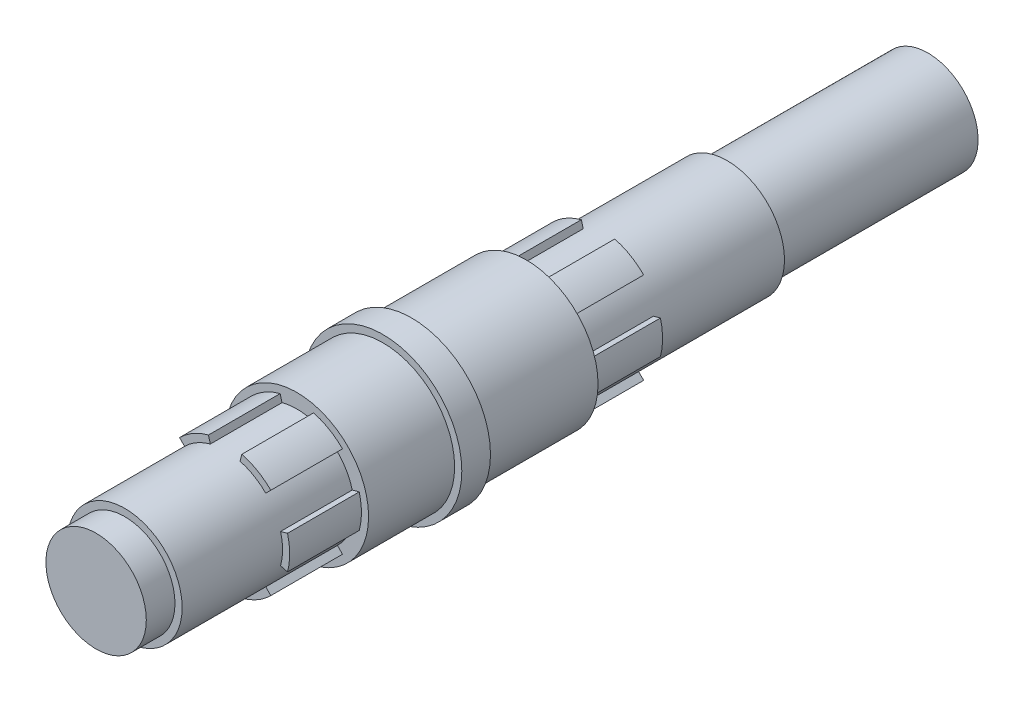
from build123d import *

# Parameters (mm, degrees)
CUT_EXTRUDE2_START  = -31.75
CUT_EXTRUDE2_DEPTH  = 31.75
CIRPATTERN1_COUNT   = 6
CUT_EXTRUDE3_DEPTH  = 31.75
CIRPATTERN2_COUNT   = 6
CUT_EXTRUDE4_START  = -12.7
SKETCH7_R           = 25.4
SKETCH7_R_2         = 22.225
CUT_EXTRUDE4_DEPTH  = 12.7
SKETCH8_R           = 25.4
SKETCH8_R_2         = 22.225
CUT_EXTRUDE5_DEPTH  = 12.7
BOSS_EXTRUDE1_START = -38.1
SKETCH9_R           = 34.925
BOSS_EXTRUDE1_DEPTH = 12.7
BOSS_EXTRUDE2_START = 76.2
SKETCH10_R          = 22.225
BOSS_EXTRUDE2_DEPTH = 76.2


with BuildPart() as part:
    # Sketch3 → Revolve1 (revolve)
    with BuildSketch(Plane(origin=(0, 0, 0), x_dir=(0, 0, -1), z_dir=(1, 0, 0)), mode=Mode.PRIVATE) as revolve1_sk:
        Polygon((-146.05, 0), (-146.05, 25.4), (-88.9, 25.4), (-88.9, 28.575), (-57.15, 28.575), (-57.15, 31.75), (44.45, 31.75), (44.45, 28.575), (76.2, 28.575), (76.2, 25.4), (146.05, 25.4), (146.05, 0), align=None)
    revolve(revolve1_sk.sketch.rotate(Axis((0, 0, 128.279136691), (0, 0, -1)), 90), axis=Axis((0, 0, 128.279136691), (0, 0, -1)))

    # Sketch5 → Cut-Extrude2 (cut)
    with BuildSketch(Plane.XY.offset(88.9).offset(CUT_EXTRUDE2_START)):
        with BuildLine():
            Line((0, 28.575), (0, 25.4))
            ThreePointArc((0, 25.4), (3.315365282, 25.182699479), (6.574003746, 24.534515988))
            Line((6.574003746, 24.534515988), (7.395754214, 27.601330486))
            ThreePointArc((7.395754214, 27.601330486), (3.729785943, 28.330536914), (0, 28.575))
        make_face()
        with BuildLine():
            ThreePointArc((-6.574003746, 24.534515988), (-3.315365282, 25.182699479), (0, 25.4))
            Line((0, 25.4), (0, 28.575))
            ThreePointArc((0, 28.575), (-3.729785943, 28.330536914), (-7.395754214, 27.601330486))
            Line((-7.395754214, 27.601330486), (-6.574003746, 24.534515988))
        make_face()
    cut_extrude2 = extrude(amount=CUT_EXTRUDE2_DEPTH, mode=Mode.SUBTRACT)

    # CirPattern1: Cut-Extrude2 ×6 about axis
    cirpattern1_axis = Axis((0, 0, 0), (0, 0, 1))
    for i in range(1, CIRPATTERN1_COUNT):
        add(cut_extrude2.rotate(cirpattern1_axis, i * 360 / CIRPATTERN1_COUNT), mode=Mode.SUBTRACT)

    # Sketch6 → Cut-Extrude3 (cut)
    with BuildSketch(Plane(origin=(0, 0, -76.2), x_dir=(-1, 0, 0), z_dir=(0, 0, -1))):
        with BuildLine():
            Line((0, 28.575), (0, 25.4))
            ThreePointArc((0, 25.4), (3.315365282, 25.182699479), (6.574003746, 24.534515988))
            Line((6.574003746, 24.534515988), (7.395754214, 27.601330486))
            ThreePointArc((7.395754214, 27.601330486), (3.729785943, 28.330536914), (0, 28.575))
        make_face()
        with BuildLine():
            ThreePointArc((-6.574003746, 24.534515988), (-3.315365282, 25.182699479), (0, 25.4))
            Line((0, 25.4), (0, 28.575))
            ThreePointArc((0, 28.575), (-3.729785943, 28.330536914), (-7.395754214, 27.601330486))
            Line((-7.395754214, 27.601330486), (-6.574003746, 24.534515988))
        make_face()
    cut_extrude3 = extrude(amount=-CUT_EXTRUDE3_DEPTH, mode=Mode.SUBTRACT)

    # CirPattern2: Cut-Extrude3 ×6 about axis
    cirpattern2_axis = Axis((0, 0, 0), (0, 0, 1))
    for i in range(1, CIRPATTERN2_COUNT):
        add(cut_extrude3.rotate(cirpattern2_axis, i * 360 / CIRPATTERN2_COUNT), mode=Mode.SUBTRACT)

    # Sketch7 → Cut-Extrude4 (cut)
    with BuildSketch(Plane.XY.offset(146.05).offset(CUT_EXTRUDE4_START)):
        Circle(SKETCH7_R)
        Circle(SKETCH7_R_2, mode=Mode.SUBTRACT)
    extrude(amount=CUT_EXTRUDE4_DEPTH, mode=Mode.SUBTRACT)

    # Sketch8 → Cut-Extrude5 (cut)
    with BuildSketch(Plane(origin=(0, 0, -146.05), x_dir=(-1, 0, 0), z_dir=(0, 0, -1))):
        with Locations(Location((0, 0, 0), (0, 0, 195))):
            Circle(SKETCH8_R)
        with Locations(Location((0, 0, 0), (0, 0, 180))):
            Circle(SKETCH8_R_2, mode=Mode.SUBTRACT)
    extrude(amount=-CUT_EXTRUDE5_DEPTH, mode=Mode.SUBTRACT)

    # Sketch9 → Boss-Extrude1 (add)
    with BuildSketch(Plane.XY.offset(57.15).offset(BOSS_EXTRUDE1_START)):
        Circle(SKETCH9_R)
    extrude(amount=-BOSS_EXTRUDE1_DEPTH)

    # Sketch10 → Boss-Extrude2 (add)
    with BuildSketch(Plane(origin=(0, 0, -146.05), x_dir=(-1, 0, 0), z_dir=(0, 0, -1)).offset(BOSS_EXTRUDE2_START)):
        Circle(SKETCH10_R)
    extrude(amount=-BOSS_EXTRUDE2_DEPTH)


solid = part.part
